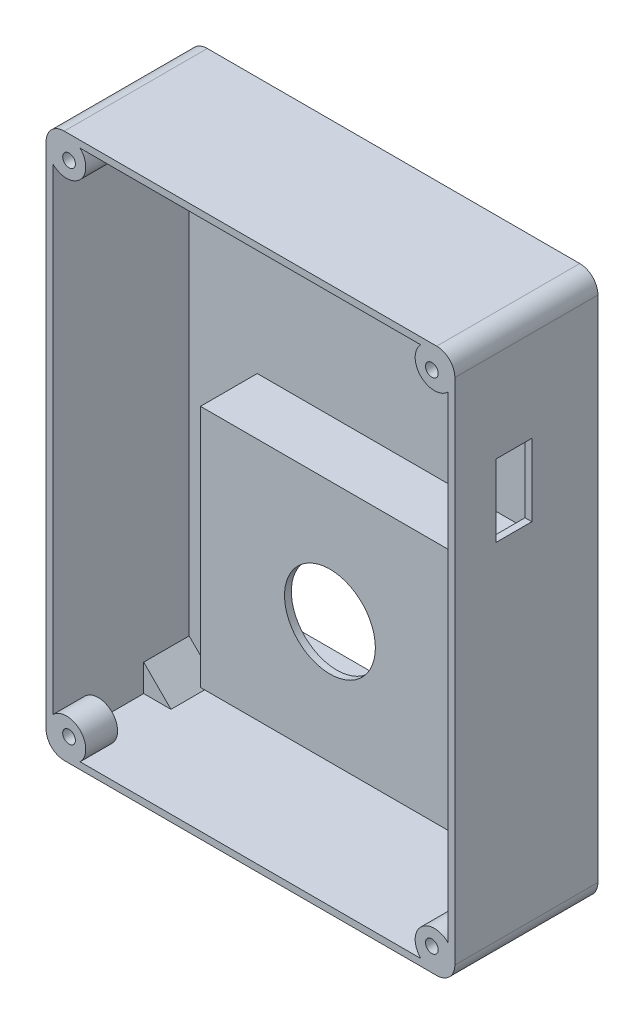
from build123d import *

# Parameters (mm, degrees)
SKETCH2_W                = 90
SKETCH2_H                = 120
BOSS_EXTRUDE1_DEPTH      = 31.5
SKETCH4_W                = 87
SKETCH4_H                = 117
CUT_EXTRUDE1_DEPTH       = 30
FILLET4_R                = 4
SKETCH18_W               = 57
SKETCH18_H               = 53.6
KHAY_PIN_DEPTH           = 12.5
SKETCH21_W               = 53
SKETCH21_H               = 49.6
BOSS_EXTRUDE11_DEPTH     = 15
SKETCH22_W               = 53
SKETCH22_H               = 49.6
CUT_EXTRUDE4_DEPTH       = 13.5
SKETCH30_W               = 7
SKETCH30_H               = 14
CUT_EXTRUDE8_DEPTH       = 5
SKETCH34_R               = 4.242640687
BOSS_EXTRUDE12_DEPTH     = 7
SKETCH37_W               = 7.9
SKETCH37_H               = 15.9
CUT_EXTRUDE10_DEPTH      = 5
MIRROR2_COPY_1_SKETCH_R  = 4.242640687
MIRROR2_COPY_1_DEPTH     = 7
SKETCH38_R               = 10
CUT_EXTRUDE11_DEPTH      = 10
SKETCH40_W               = 6
SKETCH40_H               = 49.6
BOSS_EXTRUDE13_DEPTH     = 5.8
SKETCH48_W               = 71
SKETCH48_H               = 6
BOSS_EXTRUDE14_DEPTH     = 5.8
SKETCH50_W               = 2.3
SKETCH50_H               = 1.8
CUT_EXTRUDE14_DEPTH      = 49.6
SKETCH52_R               = 1.4
CUT_EXTRUDE15_DEPTH      = 10
MIRROR10_COPY_1_SKETCH_R = 1.4
MIRROR10_COPY_1_DEPTH    = 10
BOSS_EXTRUDE16_DEPTH     = 10


with BuildPart() as part:
    # Sketch2 → Boss-Extrude1 (new body)
    with BuildSketch(Plane.XY):
        Rectangle(SKETCH2_W, SKETCH2_H)
    extrude(amount=BOSS_EXTRUDE1_DEPTH)

    # Sketch4 → Cut-Extrude1 (cut)
    with BuildSketch(Plane.XY.offset(31.5)):
        Rectangle(SKETCH4_W, SKETCH4_H)
    extrude(amount=-CUT_EXTRUDE1_DEPTH, mode=Mode.SUBTRACT)

    # Fillet4
    fillet4_edges = [part.edges().sort_by_distance(p)[0] for p in [
        (45, -60, 15.75),
        (-45, -60, 15.75),
        (-45, 60, 15.75),
        (45, 60, 15.75),
    ]]
    fillet(fillet4_edges, radius=FILLET4_R)

    # Sketch18 → khay_pin (add)
    with BuildSketch(Plane.XY.offset(1.5)):
        with Locations((0, -21.775547075)):
            Rectangle(SKETCH18_W, SKETCH18_H)
    extrude(amount=KHAY_PIN_DEPTH)

    # Sketch21 → Boss-Extrude11 (add)
    with BuildSketch(Plane.XY.offset(14)):
        with Locations((0, -21.775547075)):
            Rectangle(SKETCH21_W, SKETCH21_H)
    extrude(amount=-BOSS_EXTRUDE11_DEPTH)

    # Sketch22 → Cut-Extrude4 (cut)
    with BuildSketch(Plane(origin=(0, 0, -1), x_dir=(-1, 0, 0), z_dir=(0, 0, -1))):
        with Locations((0, -21.775547075)):
            Rectangle(SKETCH22_W, SKETCH22_H)
    extrude(amount=-CUT_EXTRUDE4_DEPTH, mode=Mode.SUBTRACT)

    # Sketch30 → Cut-Extrude8 (cut)
    with BuildSketch(Plane.ZY.offset(-26.5)):
        with Locations((9, -8.975547075)):
            Rectangle(SKETCH30_W, SKETCH30_H)
    extrude(amount=-CUT_EXTRUDE8_DEPTH, mode=Mode.SUBTRACT)

    # Sketch34 → Boss-Extrude12 (add)
    with BuildSketch(Plane.XY.offset(31.5)):
        with Locations((-40.5, 55.5)):
            Circle(SKETCH34_R)
    boss_extrude12 = extrude(amount=-BOSS_EXTRUDE12_DEPTH)

    # Sketch37 → Cut-Extrude10 (cut)
    with BuildSketch(Plane(origin=(45, 0, 0), x_dir=(0, 0, -1), z_dir=(1, 0, 0))):
        with Locations((-18.5, 28)):
            Rectangle(SKETCH37_W, SKETCH37_H)
    extrude(amount=-CUT_EXTRUDE10_DEPTH, mode=Mode.SUBTRACT)

    # Mirror1: Boss-Extrude12 across plane
    add(boss_extrude12.mirror(Plane(origin=(0, 0, 0), x_dir=(0, 0, 1), z_dir=(1, 0, 0))))

    # Mirror2: Boss-Extrude12 across plane
    add(boss_extrude12.mirror(Plane.ZX))

    # Mirror2 copy 1 sketch → Mirror2 copy 1 (add)
    with BuildSketch(Plane(origin=(0, 0, 31.5), x_dir=(-1, 0, 0), z_dir=(0, 0, 1))):
        with Locations((-40.5, 55.5)):
            Circle(MIRROR2_COPY_1_SKETCH_R)
    extrude(amount=-MIRROR2_COPY_1_DEPTH)

    # Sketch38 → Cut-Extrude11 (cut)
    with BuildSketch(Plane.XY.offset(14)):
        with Locations((0, -21.775547075)):
            Circle(SKETCH38_R)
    extrude(amount=-CUT_EXTRUDE11_DEPTH, mode=Mode.SUBTRACT)

    # Sketch40 → Boss-Extrude13 (add)
    with BuildSketch(Plane(origin=(0, 0, 0), x_dir=(-1, 0, 0), z_dir=(0, 0, -1))):
        with Locations((-32.5, -21.775547075)):
            Rectangle(SKETCH40_W, SKETCH40_H)
    boss_extrude13 = extrude(amount=BOSS_EXTRUDE13_DEPTH)

    # Mirror3: Boss-Extrude13 across plane
    add(boss_extrude13.mirror(Plane(origin=(0, 0, 0), x_dir=(0, 0, 1), z_dir=(1, 0, 0))))

    # Sketch48 → Boss-Extrude14 (add)
    with BuildSketch(Plane(origin=(0, 0, 0), x_dir=(-1, 0, 0), z_dir=(0, 0, -1))):
        with Locations((0, -49.575547075)):
            Rectangle(SKETCH48_W, SKETCH48_H)
    extrude(amount=BOSS_EXTRUDE14_DEPTH)

    # Sketch50 → Cut-Extrude14 (cut)
    with BuildSketch(Plane(origin=(0, 3.024452925, 0), x_dir=(1, 0, 0), z_dir=(0, 1, 0))):
        with Locations((30.65, 2.9)):
            Rectangle(SKETCH50_W, SKETCH50_H)
    cut_extrude14 = extrude(amount=-CUT_EXTRUDE14_DEPTH, mode=Mode.SUBTRACT)

    # Mirror7: Cut-Extrude14 across plane
    add(cut_extrude14.mirror(Plane(origin=(0, 0, 0), x_dir=(0, 0, 1), z_dir=(1, 0, 0))), mode=Mode.SUBTRACT)

    # Sketch52 → Cut-Extrude15 (cut)
    with BuildSketch(Plane.XY.offset(31.5)):
        with Locations((-39.939339828, 54.939339828)):
            Circle(SKETCH52_R)
    cut_extrude15 = extrude(amount=-CUT_EXTRUDE15_DEPTH, mode=Mode.SUBTRACT)

    # Mirror9: Cut-Extrude15 across plane
    add(cut_extrude15.mirror(Plane(origin=(0, 0, 0), x_dir=(0, 0, 1), z_dir=(1, 0, 0))), mode=Mode.SUBTRACT)

    # Mirror10: Cut-Extrude15 across plane
    add(cut_extrude15.mirror(Plane.ZX), mode=Mode.SUBTRACT)

    # Mirror10 copy 1 sketch → Mirror10 copy 1 (cut)
    with BuildSketch(Plane(origin=(0, 0, 31.5), x_dir=(-1, 0, 0), z_dir=(0, 0, 1))):
        with Locations((-39.939339828, 54.939339828)):
            Circle(MIRROR10_COPY_1_SKETCH_R)
    extrude(amount=-MIRROR10_COPY_1_DEPTH, mode=Mode.SUBTRACT)

    # Sketch51 → Boss-Extrude16 (add)
    with BuildSketch(Plane.XY.offset(1.5)):
        Polygon((43.5, -52.5), (37.5, -58.5), (43.5, -58.5), align=None)
    boss_extrude16 = extrude(amount=BOSS_EXTRUDE16_DEPTH)

    # Mirror11: Boss-Extrude16 across plane
    add(boss_extrude16.mirror(Plane(origin=(0, 0, 0), x_dir=(0, 0, 1), z_dir=(1, 0, 0))))


solid = part.part
